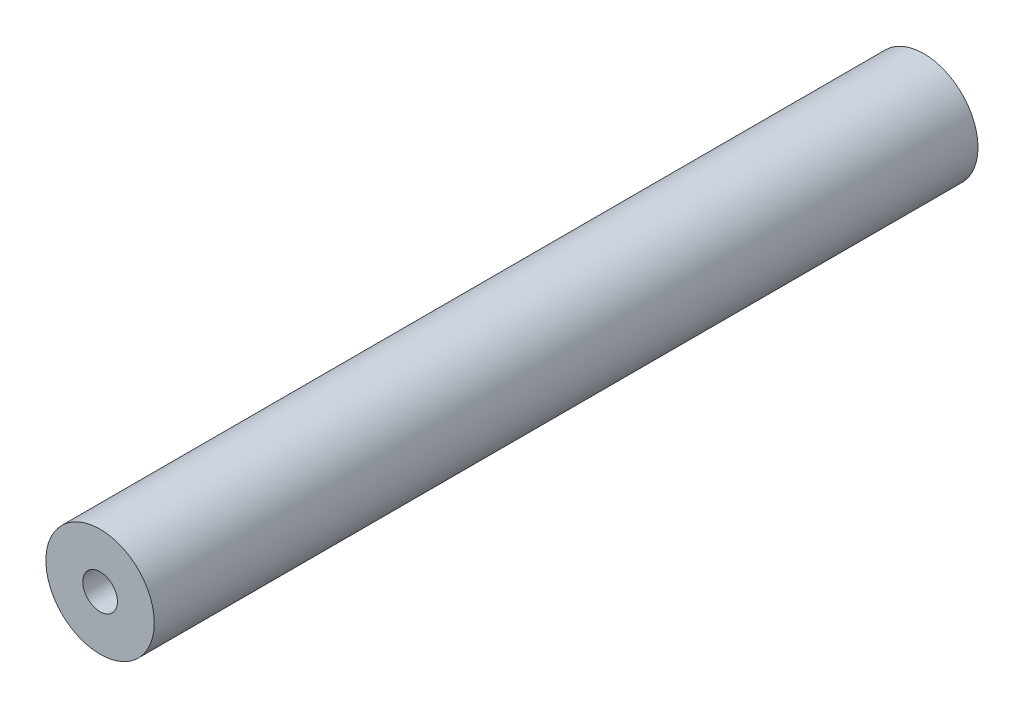
from build123d import *

# Parameters (mm, degrees)
SKETCH1_R           = 12.5
BOSS_EXTRUDE1_DEPTH = 190
SKETCH2_R           = 4
CUT_EXTRUDE1_DEPTH  = 395


with BuildPart() as part:
    # Sketch1 → Boss-Extrude1 (new body)
    with BuildSketch(Plane.XY):
        Circle(SKETCH1_R)
    extrude(amount=BOSS_EXTRUDE1_DEPTH)

    # Sketch2 → Cut-Extrude1 (cut)
    with BuildSketch(Plane.XY):
        with Locations(Location((0, 0, 0), (0, 0, 180))):
            Circle(SKETCH2_R)
    extrude(amount=CUT_EXTRUDE1_DEPTH, mode=Mode.SUBTRACT)


solid = part.part
